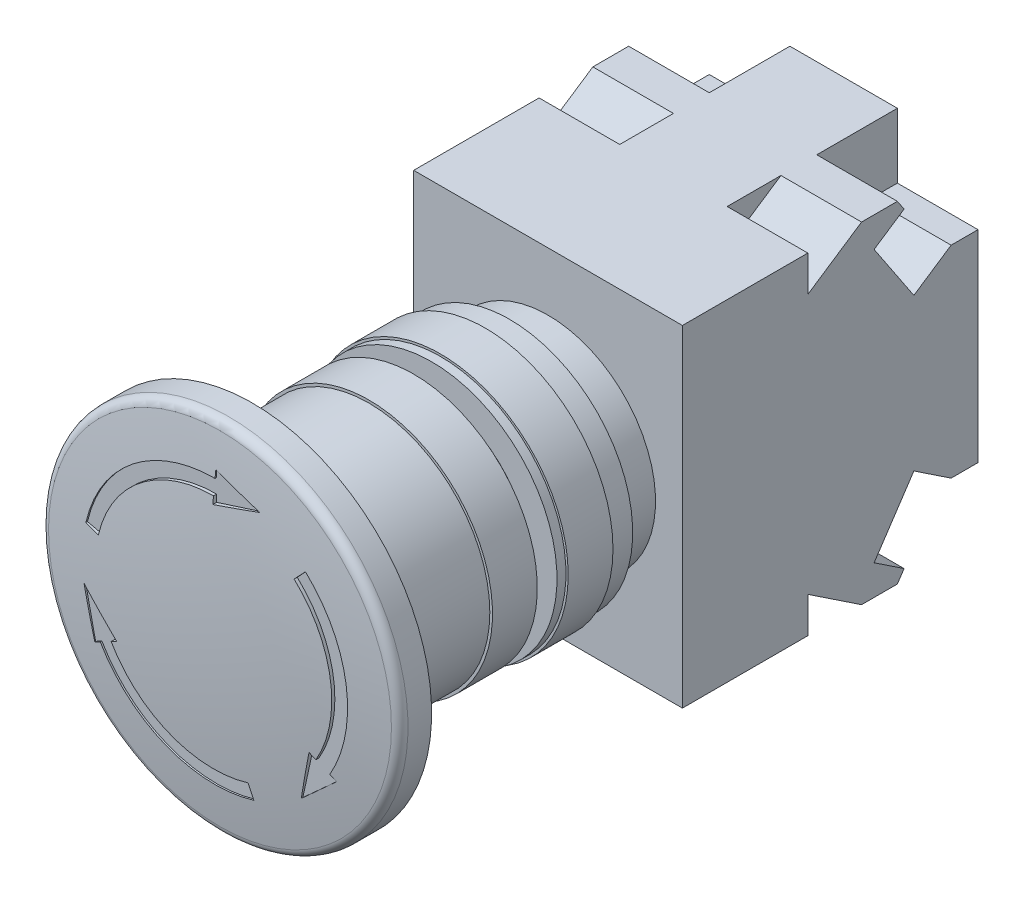
from build123d import *

# Parameters (mm, degrees)
ESQUISSE1_W             = 33
ESQUISSE1_H             = 37
BOSS_EXTRU_1_DEPTH      = 15
ENL_V_MAT_EXTRU_1_DEPTH = 9
ENL_V_MAT_EXTRU_2_DEPTH = 9
ESQUISSE4_R             = 12
BOSS_EXTRU_2_DEPTH      = 8
ESQUISSE5_R             = 11
BOSS_EXTRU_3_DEPTH      = 8.5
ESQUISSE6_R             = 7.775
BOSS_EXTRU_4_DEPTH      = 5.8
ESQUISSE7_R             = 10
BOSS_EXTRU_5_DEPTH      = 4
ESQUISSE8_R             = 8.5
BOSS_EXTRU_6_DEPTH      = 5
ESQUISSE10_W            = 1
ESQUISSE10_H            = 3
CONG_1_R                = 1
ENL_V_MAT_EXTRU_3_DEPTH = 1


with BuildPart() as part:
    # Esquisse1 → Boss.-Extru.1 (new, symmetric)
    with BuildSketch(Plane(origin=(0, 0, 0), x_dir=(0, 0, -1), z_dir=(1, 0, 0))):
        with Locations((-16.5, 0)):
            Rectangle(ESQUISSE1_W, ESQUISSE1_H)
    extrude(amount=BOSS_EXTRU_1_DEPTH, both=True)

    # Esquisse2 → Enlèv. mat.-Extru.1 (cut)
    with BuildSketch(Plane(origin=(15, 0, 0), x_dir=(0, 0, -1), z_dir=(1, 0, 0))):
        Polygon((-9, -18.5), (-8.251601476, -17.377402213), (-11.597853041, -15.146567836), (-7.160251472, -8.490165481), (-3, -11.263666462), (0, -11.263666462), (0, -20.603237272), (-19, -20.603237272), (-19, -18.5), (-19, -14.5), (-13, -18.5), align=None)
        Polygon((-19, 20.603237272), (0, 20.603237272), (0, 11.263666462), (-3, 11.263666462), (-7.160251472, 8.490165481), (-11.597853041, 15.146567836), (-8.251601476, 17.377402213), (-9, 18.5), (-13, 18.5), (-19, 14.5), (-19, 18.5), align=None)
    extrude(amount=-ENL_V_MAT_EXTRU_1_DEPTH, mode=Mode.SUBTRACT)

    # Esquisse3 → Enlèv. mat.-Extru.2 (cut)
    with BuildSketch(Plane.ZY.offset(15)):
        Polygon((-2.98504772, 11.263666462), (3, 11.263666462), (7.160251472, 8.490165481), (11.597853041, 15.146567836), (8.251601476, 17.377402213), (9, 18.5), (13, 18.5), (19, 14.5), (19, 18.5), (21.50409999, 22.256149985), (-2.98504772, 22.256149985), align=None)
        Polygon((-2.98504772, -22.256149985), (-2.98504772, -11.263666462), (3, -11.263666462), (7.160251472, -8.490165481), (11.597853041, -15.146567836), (8.251601476, -17.377402213), (9, -18.5), (13, -18.5), (19, -14.5), (19, -18.5), (21.50409999, -22.256149985), align=None)
    extrude(amount=-ENL_V_MAT_EXTRU_2_DEPTH, mode=Mode.SUBTRACT)

    # Esquisse4 → Boss.-Extru.2 (add)
    with BuildSketch(Plane.XY.offset(33)):
        with Locations(Location((0, 0, 0), (0, 0, 180))):
            Circle(ESQUISSE4_R)
    extrude(amount=BOSS_EXTRU_2_DEPTH)

    # Esquisse5 → Boss.-Extru.3 (add)
    with BuildSketch(Plane.XY.offset(41)):
        Circle(ESQUISSE5_R)
    extrude(amount=BOSS_EXTRU_3_DEPTH)

    # Esquisse6 → Boss.-Extru.4 (add)
    with BuildSketch(Plane.XY.offset(49.5)):
        Circle(ESQUISSE6_R)
    extrude(amount=BOSS_EXTRU_4_DEPTH)

    # Esquisse7 → Boss.-Extru.5 (add)
    with BuildSketch(Plane.XY.offset(55.3)):
        Circle(ESQUISSE7_R)
    extrude(amount=BOSS_EXTRU_5_DEPTH)

    # Esquisse8 → Boss.-Extru.6 (add)
    with BuildSketch(Plane.XY.offset(59.3)):
        Circle(ESQUISSE8_R)
    extrude(amount=BOSS_EXTRU_6_DEPTH)


with BuildPart() as body_2:
    # Esquisse9 → Révolution1 (revolve)
    with BuildSketch(Plane(origin=(0, 0, 0), x_dir=(0, 0, -1), z_dir=(1, 0, 0)), mode=Mode.PRIVATE) as r_volution1_sk:
        Polygon((-45, 12), (-37.3, 12), (-37.3, 13.75), (-40, 13.75), (-40, 14.25), (-45, 14.25), align=None)
    revolve(r_volution1_sk.sketch.rotate(Axis((0, 0, -56.84), (0, 0, 1)), 90), axis=Axis((0, 0, -56.84), (0, 0, 1)))


with BuildPart() as body_3:
    # Esquisse10 → Révolution2 (revolve)
    with BuildSketch(Plane(origin=(0, 0, 0), x_dir=(0, 0, -1), z_dir=(1, 0, 0)), mode=Mode.PRIVATE) as r_volution2_sk:
        with Locations((-45.5, 12.5)):
            Rectangle(ESQUISSE10_W, ESQUISSE10_H)
    revolve(r_volution2_sk.sketch.rotate(Axis((0, 0, -56.84), (0, 0, 1)), 90), axis=Axis((0, 0, -56.84), (0, 0, 1)))


with BuildPart() as body_4:
    # Esquisse11 → Révolution3 (revolve)
    with BuildSketch(Plane(origin=(0, 0, 0), x_dir=(0, 0, -1), z_dir=(1, 0, 0)), mode=Mode.PRIVATE) as r_volution3_sk:
        Polygon((-48, 11), (-48, 13.8), (-53, 13.8), (-53, 13.5), (-62, 13.5), (-62, 11), align=None)
    revolve(r_volution3_sk.sketch.rotate(Axis((0, 0, -56.84), (0, 0, 1)), 90), axis=Axis((0, 0, -56.84), (0, 0, 1)))


with BuildPart() as body_5:
    # Esquisse12 → Révolution4 (revolve)
    with BuildSketch(Plane(origin=(0, 0, 0), x_dir=(0, 0, -1), z_dir=(1, 0, 0)), mode=Mode.PRIVATE) as r_volution4_sk:
        with BuildLine():
            Line((-69.5, 11.25), (-60.5, 11.25))
            Line((-60.5, 11.25), (-60.5, 8.5))
            Line((-60.5, 8.5), (-69.5, 8.5))
            Line((-69.5, 8.5), (-69.5, 0))
            Line((-69.5, 0), (-71, 0))
            ThreePointArc((-71, 0), (-70.624474134, 10.02808556), (-69.5, 20))
            Line((-69.5, 20), (-66, 20))
            Line((-66, 20), (-66, 18.5))
            Line((-66, 18.5), (-68.5, 18.5))
            ThreePointArc((-68.5, 18.5), (-69.248822118, 14.909320292), (-69.5, 11.25))
        make_face()
    revolve(r_volution4_sk.sketch.rotate(Axis((0, 0, -56.84), (0, 0, 1)), 90), axis=Axis((0, 0, -56.84), (0, 0, 1)))

    # Congé1
    cong_1_edges = [body_5.edges().sort_by_distance(p)[0] for p in [
        (18.5, 0, 68.5),
        (20, 0, 69.5),
    ]]
    fillet(cong_1_edges, radius=CONG_1_R)

    # Esquisse13 → Enlèv. mat.-Extru.3 (cut)
    with BuildSketch(Plane.XY.offset(71)):
        with BuildLine():
            Line((0, 15.6), (0, 14.8))
            ThreePointArc((0, 14.8), (-9.214255263, 11.581774473), (-14.421273837, 3.326689182))
            Line((-14.421273837, 3.326689182), (-12.862217206, 2.967047108))
            ThreePointArc((-12.862217206, 2.967047108), (-8.218119559, 10.329690746), (0, 13.2))
            Line((0, 13.2), (0, 12.4))
            Line((0, 12.4), (5, 14))
            Line((5, 14), (0, 15.6))
        make_face()
        with BuildLine():
            Line((9.000646773, 9.655483295), (10.091634261, 10.825844907))
            ThreePointArc((10.091634261, 10.825844907), (14.637238546, 2.188891898), (12.817175976, -7.4))
            Line((12.817175976, -7.4), (13.509996299, -7.8))
            Line((13.509996299, -7.8), (9.624355653, -11.330127019))
            Line((9.624355653, -11.330127019), (10.738715007, -6.2))
            Line((10.738715007, -6.2), (11.43153533, -6.6))
            ThreePointArc((11.43153533, -6.6), (13.054834379, 1.952254936), (9.000646773, 9.655483295))
        make_face()
        with BuildLine():
            Line((3.861570433, -12.622530404), (4.329639576, -14.152534089))
            ThreePointArc((4.329639576, -14.152534089), (-5.422983283, -13.770666371), (-12.817175976, -7.4))
            Line((-12.817175976, -7.4), (-13.509996299, -7.8))
            Line((-13.509996299, -7.8), (-14.624355653, -2.669872981))
            Line((-14.624355653, -2.669872981), (-10.738715007, -6.2))
            Line((-10.738715007, -6.2), (-11.43153533, -6.6))
            ThreePointArc((-11.43153533, -6.6), (-4.83671482, -12.281945683), (3.861570433, -12.622530404))
        make_face()
    extrude(amount=-ENL_V_MAT_EXTRU_3_DEPTH, mode=Mode.SUBTRACT)


solid = Compound([part.part, body_2.part, body_3.part, body_4.part, body_5.part])
